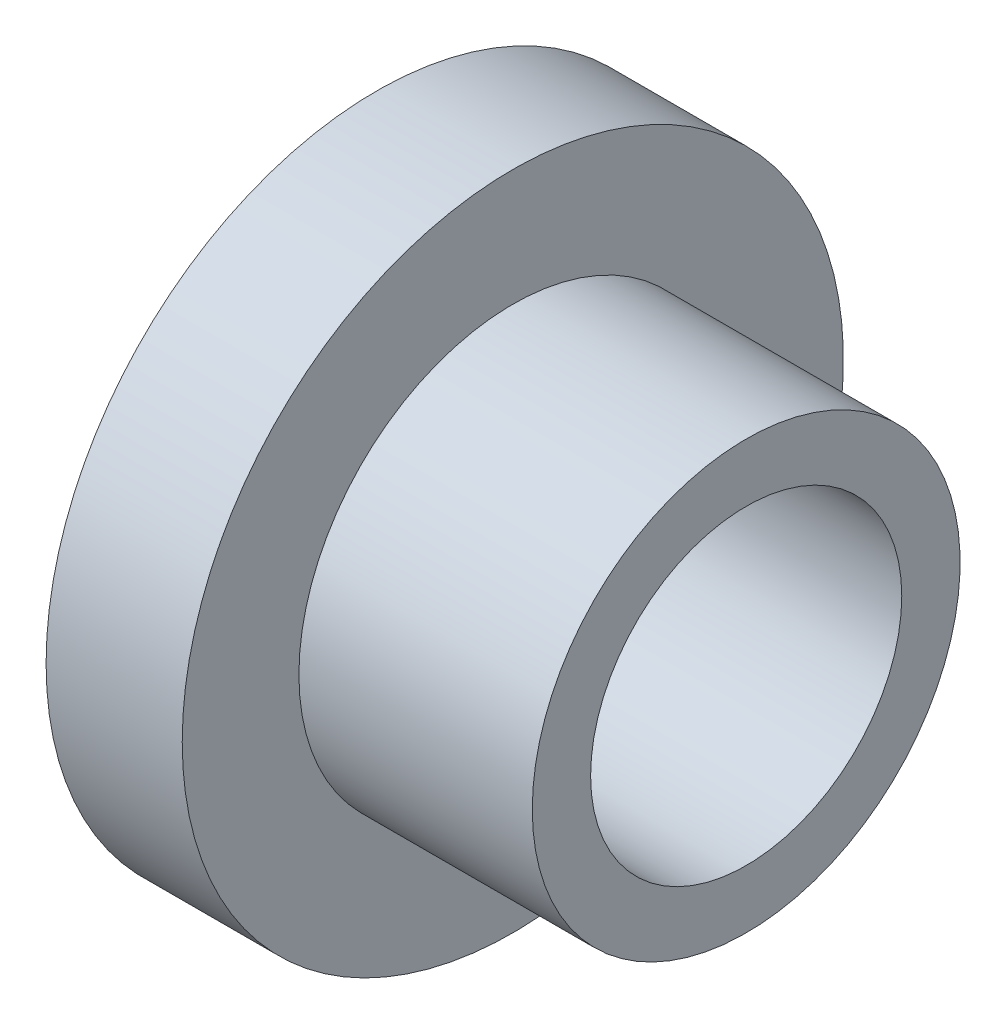
from build123d import *


with BuildPart() as part:
    # 草圖1 → 旋轉1 (revolve)
    with BuildSketch(Plane.XY, mode=Mode.PRIVATE) as revolve_1_sk:
        Polygon((0, 8), (0, 17), (7, 17), (7, 11), (19, 11), (19, 8), align=None)
    revolve(revolve_1_sk.sketch.rotate(Axis((0, 0, 0), (1, 0, 0)), 90), axis=Axis((0, 0, 0), (1, 0, 0)))


solid = part.part
